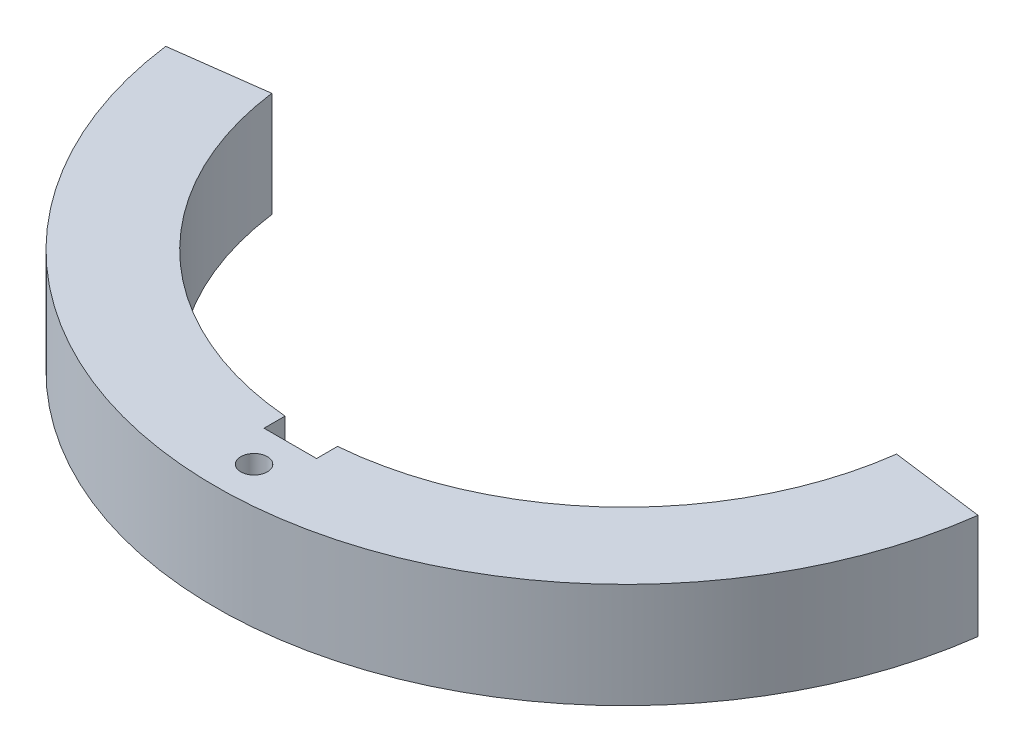
from build123d import *

# Parameters (mm, degrees)
SKETCH1_R               = 49.53
SKETCH1_R_2             = 38.1
BOSS_EXTRUDE1_DEPTH     = 12.7
CUT_EXTRUDE1_DEPTH      = 72.188003203
CUT_EXTRUDE1_DEPTH_BACK = 72.188003203
SKETCH8_W               = 6.35
SKETCH8_H               = 75.934955718
CUT_EXTRUDE3_DEPTH      = 71.893836562
SKETCH9_W               = 6.35
SKETCH9_H               = 12.7
CUT_EXTRUDE4_DEPTH      = 2.54
SKETCH10_R              = 1.6
CUT_EXTRUDE5_DEPTH      = 5.08


with BuildPart() as part:
    # Sketch1 → Boss-Extrude1 (new body)
    # profile 1 of 2: a face of its own
    with BuildSketch(Plane(origin=(0, 0, 0), x_dir=(1, 0, 0), z_dir=(0, 1, 0))):
        with Locations(Location((0, 0, 0), (0, 0, 270))):
            Circle(SKETCH1_R)
        Circle(SKETCH1_R_2, mode=Mode.SUBTRACT)
    # profile 2 of 2: a face of its own
    with BuildSketch(Plane(origin=(0, 0, 0), x_dir=(1, 0, 0), z_dir=(0, 1, 0))):
        with BuildLine():
            Line((-3.175, 37.967477859), (-3.175, -37.967477859))
            ThreePointArc((-3.175, -37.967477859), (0, -38.1), (3.175, -37.967477859))
            Line((3.175, -37.967477859), (3.175, 37.967477859))
            ThreePointArc((3.175, 37.967477859), (0, 38.1), (-3.175, 37.967477859))
        make_face()
    extrude(amount=BOSS_EXTRUDE1_DEPTH)

    # Sketch7 → Cut-Extrude1 (cut, two sides: drawn at the far end of the back side and taken through both)
    with BuildSketch(Plane.XZ.offset(-CUT_EXTRUDE1_DEPTH_BACK)):
        with BuildLine():
            Line((-49.106263984, -6.464962301), (-37.774049218, -4.973047924))
            ThreePointArc((-37.774049218, -4.973047924), (-38.1, 0), (-37.774049218, 4.973047924))
            Line((-37.774049218, 4.973047924), (-49.106263984, 6.464962301))
            ThreePointArc((-49.106263984, 6.464962301), (-49.53, 0), (-49.106263984, -6.464962301))
        make_face()
        with BuildLine():
            Line((49.106263984, 6.464962301), (37.774049218, 4.973047924))
            ThreePointArc((37.774049218, 4.973047924), (38.1, 0), (37.774049218, -4.973047924))
            Line((37.774049218, -4.973047924), (49.106263984, -6.464962301))
            ThreePointArc((49.106263984, -6.464962301), (49.53, 0), (49.106263984, 6.464962301))
        make_face()
    extrude(amount=CUT_EXTRUDE1_DEPTH + CUT_EXTRUDE1_DEPTH_BACK, mode=Mode.SUBTRACT)

    # Sketch8 → Cut-Extrude3 (cut, through all)
    with BuildSketch(Plane(origin=(0, 12.7, 0), x_dir=(1, 0, 0), z_dir=(0, 1, 0))):
        Rectangle(SKETCH8_W, SKETCH8_H)
    extrude(amount=-CUT_EXTRUDE3_DEPTH, mode=Mode.SUBTRACT)


with BuildPart() as body_2:
    # of the pieces the cut leaves, the one that is kept (cut_extrude3_keep)
    add(part.part.solids().sort_by_distance((-49.106263984, 0, 6.464962301))[0])

    # Sketch9 → Cut-Extrude4 (cut)
    with BuildSketch(Plane(origin=(0, 0, 37.967477859), x_dir=(-1, 0, 0), z_dir=(0, 0, -1))):
        with Locations((0, 6.35)):
            Rectangle(SKETCH9_W, SKETCH9_H)
    extrude(amount=-CUT_EXTRUDE4_DEPTH, mode=Mode.SUBTRACT)

    # Sketch10 → Cut-Extrude5 (cut)
    with BuildSketch(Plane(origin=(0, 12.7, 0), x_dir=(1, 0, 0), z_dir=(0, 1, 0))):
        with Locations(Location((0, -44.885010743, 0), (0, 0, 270))):
            Circle(SKETCH10_R)
    extrude(amount=-CUT_EXTRUDE5_DEPTH, mode=Mode.SUBTRACT)


solid = body_2.part
